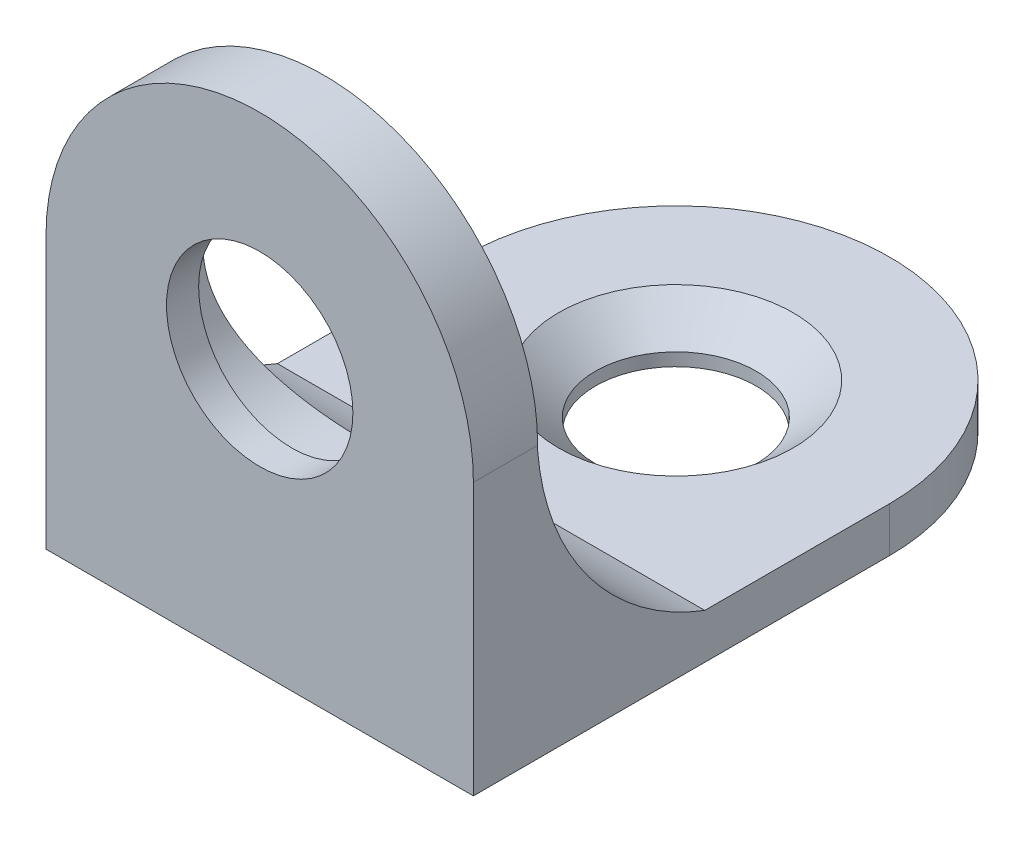
from build123d import *

# Parameters (mm, degrees)
ESQUISSE1_R             = 2.9
BOSS_EXTRU_3_DEPTH      = 2
ESQUISSE4_R             = 2.5
BOSS_EXTRU_4_DEPTH      = 1.4
BOSS_EXTRU_5_START      = -13.3
BOSS_EXTRU_5_DEPTH      = 13.3
ESQUISSE6_R             = 3.75
ENL_V_MAT_EXTRU_2_DEPTH = 1
ESQUISSE7_R             = 3.75
ENL_V_MAT_EXTRU_3_DEPTH = 25.863477231
ESQUISSE9_R             = 2.5
ESQUISSE8_R             = 3.65


with BuildPart() as part:
    # Esquisse1 → Boss.-Extru.3 (new body)
    with BuildSketch(Plane.XY):
        with BuildLine():
            Line((-6.65, 8.45), (-6.65, 0))
            Line((-6.65, 0), (6.65, 0))
            Line((6.65, 0), (6.65, 8.45))
            ThreePointArc((6.65, 8.45), (0, 15.1), (-6.65, 8.45))
        make_face()
        with Locations((0, 8.45)):
            Circle(ESQUISSE1_R, mode=Mode.SUBTRACT)
    extrude(amount=-BOSS_EXTRU_3_DEPTH)

    # Esquisse4 → Boss.-Extru.4 (add)
    with BuildSketch(Plane(origin=(0, 0, 0), x_dir=(1, 0, 0), z_dir=(0, 1, 0))):
        with BuildLine():
            Line((6.65, 0), (-6.65, 0))
            Line((-6.65, 0), (-6.65, 12.95))
            ThreePointArc((-6.65, 12.95), (0, 19.6), (6.65, 12.95))
            Line((6.65, 12.95), (6.65, 0))
        make_face()
        with Locations(Location((0, 12.95, 0), (0, 0, 270))):
            Circle(ESQUISSE4_R, mode=Mode.SUBTRACT)
    extrude(amount=BOSS_EXTRU_4_DEPTH)

    # Esquisse5 → Boss.-Extru.5 (add)
    with BuildSketch(Plane.ZY.offset(6.65).offset(BOSS_EXTRU_5_START)):
        with BuildLine():
            Line((-2, 1.4), (-2, 8.3))
            ThreePointArc((-2, 8.3), (-3.599475922, 4.095981854), (-7.2, 1.4))
            Line((-7.2, 1.4), (-2, 1.4))
        make_face()
    extrude(amount=BOSS_EXTRU_5_DEPTH)

    # Esquisse6 → Enlèv. mat.-Extru.2 (cut)
    with BuildSketch(Plane(origin=(0, 0, -2), x_dir=(-1, 0, 0), z_dir=(0, 0, -1))):
        with Locations((0, 8.45)):
            Circle(ESQUISSE6_R)
    extrude(amount=-ENL_V_MAT_EXTRU_2_DEPTH, mode=Mode.SUBTRACT)

    # Esquisse7 → Enlèv. mat.-Extru.3 (cut, through all)
    with BuildSketch(Plane(origin=(0, 0, -1), x_dir=(-1, 0, 0), z_dir=(0, 0, -1))):
        with Locations((0, 8.45)):
            Circle(ESQUISSE7_R)
    extrude(amount=ENL_V_MAT_EXTRU_3_DEPTH, mode=Mode.SUBTRACT)

    # Esquisse9 → Enlèvement de matière-Lissage1 section 0
    with BuildSketch(Plane(origin=(0, 0.4, 0), x_dir=(1, 0, 0), z_dir=(0, 1, 0))):
        with Locations((0, 12.95)):
            Circle(ESQUISSE9_R)
    # Esquisse8 → Enlèvement de matière-Lissage1 section 1
    with BuildSketch(Plane(origin=(0, 1.4, 0), x_dir=(1, 0, 0), z_dir=(0, 1, 0))):
        with Locations((0, 12.95)):
            Circle(ESQUISSE8_R)
    loft(mode=Mode.SUBTRACT)


solid = part.part
